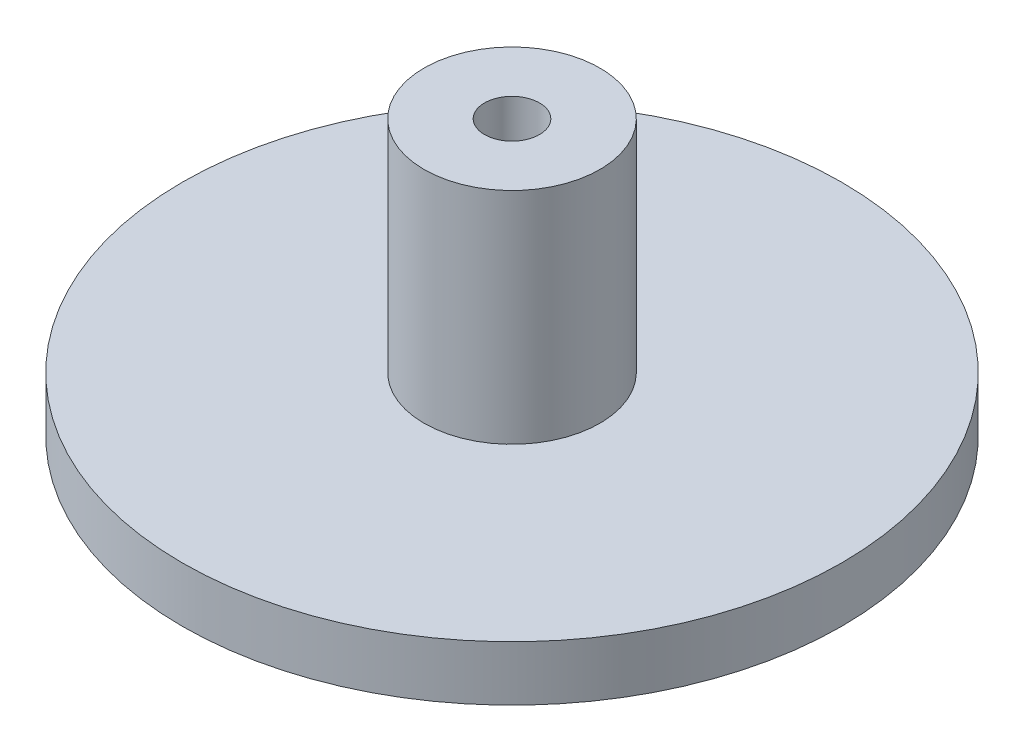
from build123d import *

# Parameters (mm, degrees)
SKETCH1_R           = 30
BOSS_EXTRUDE1_DEPTH = 5
SKETCH2_R           = 8
BOSS_EXTRUDE2_DEPTH = 20
SKETCH3_R           = 2.5
CUT_EXTRUDE1_DEPTH  = 50.244289009


with BuildPart() as part:
    # Sketch1 → Boss-Extrude1 (new body)
    with BuildSketch(Plane(origin=(0, 0, 0), x_dir=(1, 0, 0), z_dir=(0, 1, 0))):
        with Locations(Location((0, 0, 0), (0, 0, 270))):
            Circle(SKETCH1_R)
    extrude(amount=BOSS_EXTRUDE1_DEPTH)

    # Sketch2 → Boss-Extrude2 (add)
    with BuildSketch(Plane(origin=(0, 5, 0), x_dir=(1, 0, 0), z_dir=(0, 1, 0))):
        with Locations(Location((0, 0, 0), (0, 0, 270))):
            Circle(SKETCH2_R)
    extrude(amount=BOSS_EXTRUDE2_DEPTH)

    # Sketch3 → Cut-Extrude1 (cut, through all)
    with BuildSketch(Plane(origin=(0, 25, 0), x_dir=(1, 0, 0), z_dir=(0, 1, 0))):
        with Locations(Location((0, 0, 0), (0, 0, 270))):
            Circle(SKETCH3_R)
    extrude(amount=-CUT_EXTRUDE1_DEPTH, mode=Mode.SUBTRACT)


solid = part.part
